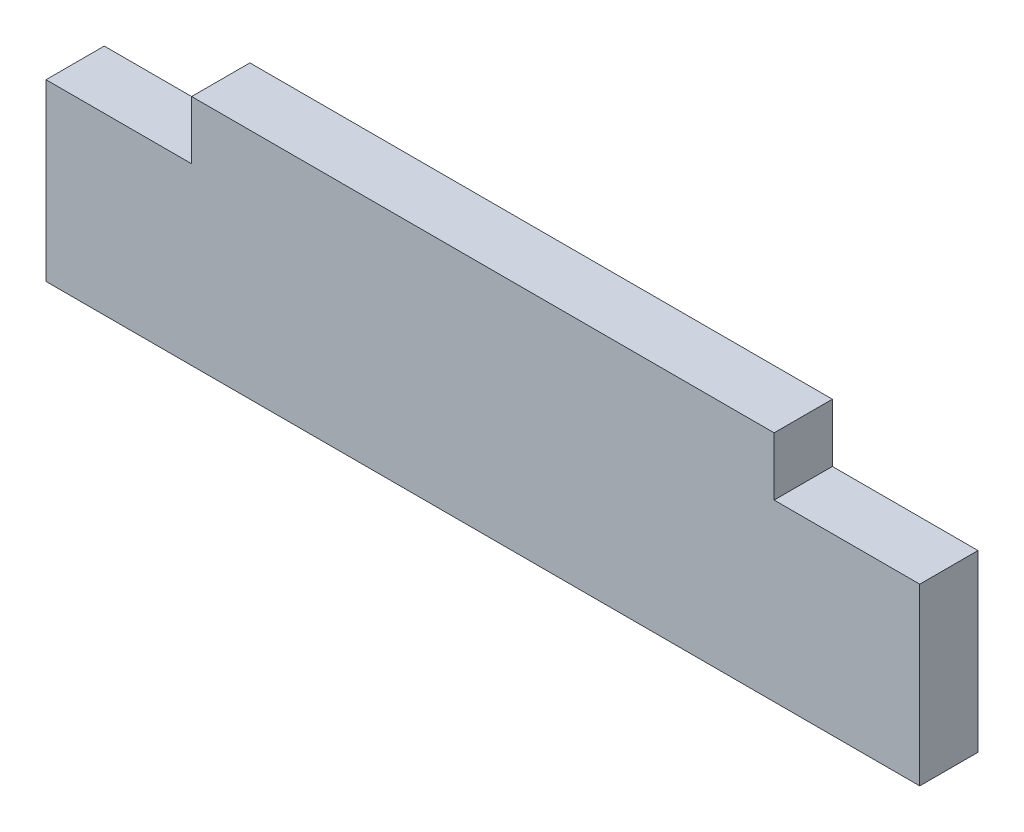
from build123d import *

# Parameters (mm, degrees)
BOSS_EXTRUDE1_DEPTH = 1.5


with BuildPart() as part:
    # Sketch1 → Boss-Extrude1 (new, symmetric)
    with BuildSketch(Plane.XY):
        Polygon((-22.5, 0), (-22.5, 9), (-15, 9), (-15, 12), (15, 12), (15, 9), (22.5, 9), (22.5, 0), align=None)
    extrude(amount=BOSS_EXTRUDE1_DEPTH, both=True)


solid = part.part
